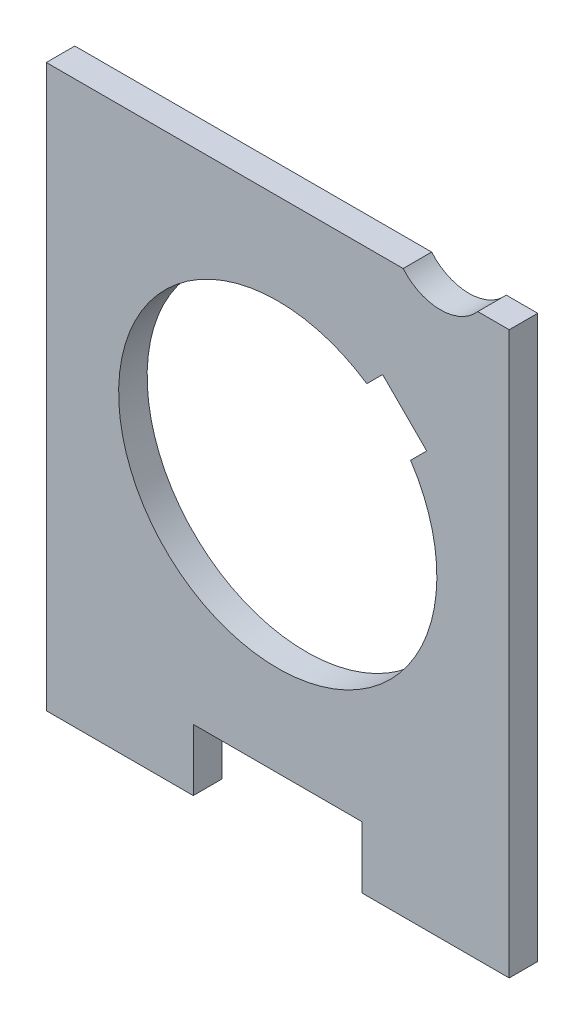
from build123d import *

# Parameters (mm, degrees)
SKETCH1_W          = 40
SKETCH1_H          = 43.18
BASE_DEPTH         = 2.4638
SKETCH2_W          = 12.7
SKETCH2_H          = 2.4638
BOTTOM_TABS_DEPTH  = 5.334
MOUNT_POINTS_DEPTH = 59.911651737
SKETCH6_R          = 4.245
CUT_EXTRUDE2_DEPTH = 66.894365141


with BuildPart() as part:
    # Sketch1 → Base (new body)
    with BuildSketch(Plane.XY):
        with Locations((20, 21.59)):
            Rectangle(SKETCH1_W, SKETCH1_H)
    extrude(amount=BASE_DEPTH)

    # Sketch2 → Bottom Tabs (add)
    with BuildSketch(Plane.XZ):
        with Locations((6.35, 1.2319)):
            Rectangle(SKETCH2_W, SKETCH2_H)
        with Locations((33.65, 1.2319)):
            Rectangle(SKETCH2_W, SKETCH2_H)
    extrude(amount=BOTTOM_TABS_DEPTH)

    # Sketch4 → Mount Points (cut, through all)
    with BuildSketch(Plane.XY.offset(2.4638)):
        with BuildLine():
            Line((31.481992586, 29.154809731), (32.871526584, 30.54434373))
            Line((32.871526584, 30.54434373), (29.061376273, 34.354494041))
            Line((29.061376273, 34.354494041), (27.693229207, 32.986346975))
            ThreePointArc((27.693229207, 32.986346975), (10.22286074, 11.922009108), (31.481992586, 29.154809731))
        make_face()
    extrude(amount=-MOUNT_POINTS_DEPTH, mode=Mode.SUBTRACT)

    # Sketch6 → Cut-Extrude2 (cut, through all)
    with BuildSketch(Plane(origin=(18.246403628, 22.293576812, 55.7276), x_dir=(1, 0, 0), z_dir=(0, 0, 1))):
        with Locations((15.813596372, 23.649057543)):
            Circle(SKETCH6_R)
    extrude(amount=-CUT_EXTRUDE2_DEPTH, mode=Mode.SUBTRACT)


solid = part.part
